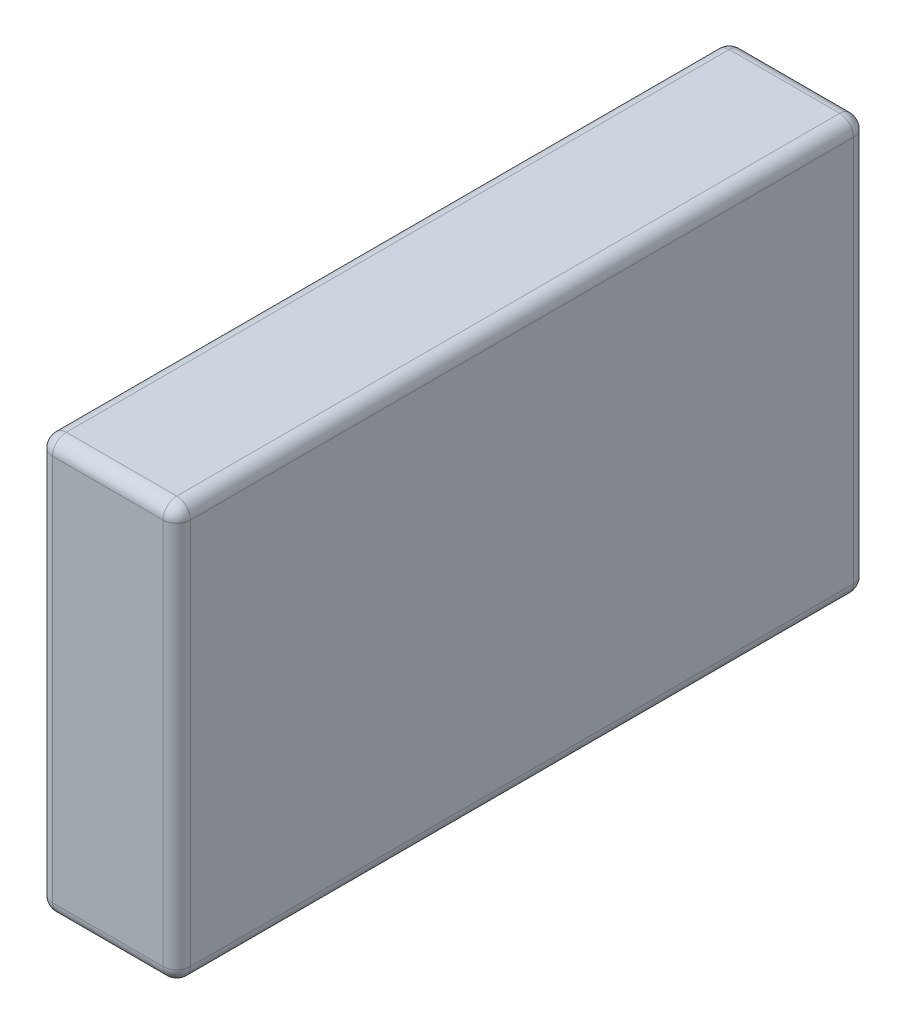
from build123d import *

# Parameters (mm, degrees)
SKETCH1_W           = 10
SKETCH1_H           = 30
BOSS_EXTRUDE1_DEPTH = 50
FILLET1_R           = 1


with BuildPart() as part:
    # Sketch1 → Boss-Extrude1 (new body)
    with BuildSketch(Plane.XY):
        with Locations((0.30982906, -12.948717949)):
            Rectangle(SKETCH1_W, SKETCH1_H)
    extrude(amount=BOSS_EXTRUDE1_DEPTH)

    # Fillet1
    fillet1_edges = [part.edges().sort_by_distance(p)[0] for p in [
        (5.30982906, -12.948717949, 50),
        (0.30982906, 2.051282051, 50),
        (-4.69017094, -12.948717949, 50),
        (0.30982906, 2.051282051, 0),
        (5.30982906, -12.948717949, 0),
        (0.30982906, -27.948717949, 0),
        (-4.69017094, -12.948717949, 0),
        (0.30982906, -27.948717949, 50),
        (-4.69017094, 2.051282051, 25),
        (5.30982906, 2.051282051, 25),
        (5.30982906, -27.948717949, 25),
        (-4.69017094, -27.948717949, 25),
    ]]
    fillet(fillet1_edges, radius=FILLET1_R)


solid = part.part
